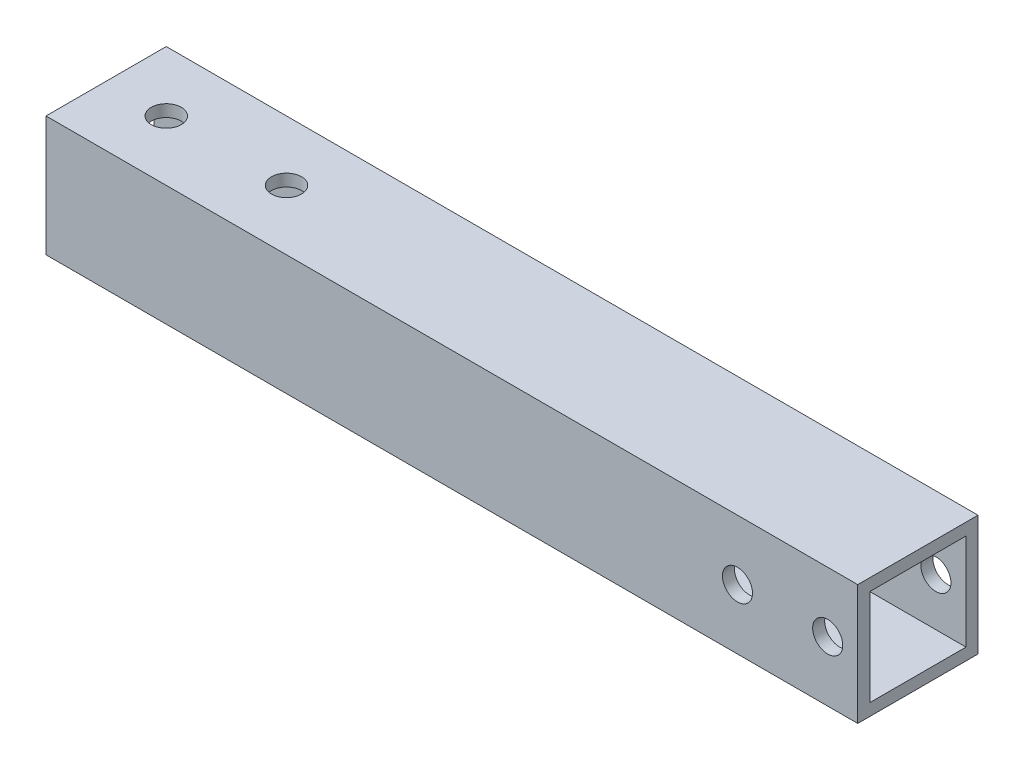
from build123d import *

# Parameters (mm, degrees)
SKETCH1_W           = 20
SKETCH1_H           = 20
SKETCH1_W_2         = 16
SKETCH1_H_2         = 16
BOSS_EXTRUDE1_DEPTH = 135
SKETCH2_R           = 2.5
CUT_EXTRUDE1_DEPTH  = 137.839321834
SKETCH3_R           = 2.5
CUT_EXTRUDE2_DEPTH  = 137.839321834


with BuildPart() as part:
    # Sketch1 → Boss-Extrude1 (new body)
    with BuildSketch(Plane(origin=(0, 0, 0), x_dir=(0, 0, -1), z_dir=(1, 0, 0))):
        Rectangle(SKETCH1_W, SKETCH1_H)
        Rectangle(SKETCH1_W_2, SKETCH1_H_2, mode=Mode.SUBTRACT)
    extrude(amount=BOSS_EXTRUDE1_DEPTH)

    # Sketch2 → Cut-Extrude1 (cut, through all)
    with BuildSketch(Plane.XY.offset(10)):
        with Locations((130, 0)):
            Circle(SKETCH2_R)
        with Locations((115, 0)):
            Circle(SKETCH2_R)
    extrude(amount=-CUT_EXTRUDE1_DEPTH, mode=Mode.SUBTRACT)

    # Sketch3 → Cut-Extrude2 (cut, through all)
    with BuildSketch(Plane(origin=(0, 10, 0), x_dir=(1, 0, 0), z_dir=(0, 1, 0))):
        with Locations(Location((10, 0, 0), (0, 0, 270))):
            Circle(SKETCH3_R)
        with Locations(Location((30, 0, 0), (0, 0, 270))):
            Circle(SKETCH3_R)
    extrude(amount=-CUT_EXTRUDE2_DEPTH, mode=Mode.SUBTRACT)


solid = part.part
